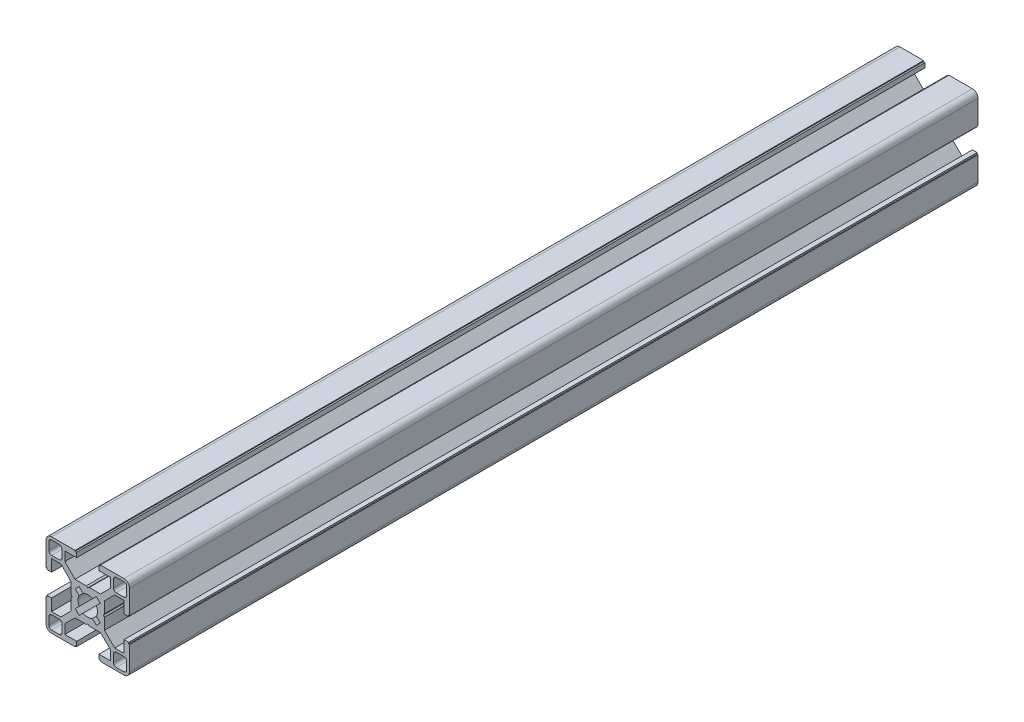
from build123d import *

# Parameters (mm, degrees)
BOSS_EXTRUDE1_DEPTH      = 152.4
BOSS_EXTRUDE1_DEPTH_BACK = 152.4
SKETCH3_R                = 3.5
CUT_EXTRUDE1_DEPTH       = 306.537297232


with BuildPart() as part:
    # Sketch3 → Boss-Extrude1 (new, two sides: drawn at the far end of the back side and taken through both)
    with BuildSketch(Plane.XY.offset(-BOSS_EXTRUDE1_DEPTH_BACK)):
        with BuildLine():
            Line((-4.55, 15), (-4.55, 14.666666667))
            Line((-4.55, 14.666666667), (-4, 14.666666667))
            Line((-4, 14.666666667), (-4, 13))
            Line((-4, 13), (-8.25, 13))
            Line((-8.25, 13), (-8.25, 9.664213562))
            Line((-8.25, 9.664213562), (-4.585786438, 6))
            Line((-4.585786438, 6), (4.585786438, 6))
            Line((4.585786438, 6), (8.25, 9.664213562))
            Line((8.25, 9.664213562), (8.25, 13))
            Line((8.25, 13), (4, 13))
            Line((4, 13), (4, 14.666666667))
            Line((4, 14.666666667), (4.55, 14.666666667))
            Line((4.55, 14.666666667), (4.55, 15))
            Line((4.55, 15), (13, 15))
            ThreePointArc((13, 15), (14.414213562, 14.414213562), (15, 13))
            Line((15, 13), (15, 4.55))
            Line((15, 4.55), (14.666666667, 4.55))
            Line((14.666666667, 4.55), (14.666666667, 4))
            Line((14.666666667, 4), (13, 4))
            Line((13, 4), (13, 8.25))
            Line((13, 8.25), (9.664213562, 8.25))
            Line((9.664213562, 8.25), (6, 4.585786438))
            Line((6, 4.585786438), (6, -4.585786438))
            Line((6, -4.585786438), (9.664213562, -8.25))
            Line((9.664213562, -8.25), (13, -8.25))
            Line((13, -8.25), (13, -4))
            Line((13, -4), (14.666666667, -4))
            Line((14.666666667, -4), (14.666666667, -4.55))
            Line((14.666666667, -4.55), (15, -4.55))
            Line((15, -4.55), (15, -13))
            ThreePointArc((15, -13), (14.414213562, -14.414213562), (13, -15))
            Line((13, -15), (4.55, -15))
            Line((4.55, -15), (4.55, -14.666666667))
            Line((4.55, -14.666666667), (4, -14.666666667))
            Line((4, -14.666666667), (4, -13))
            Line((4, -13), (8.25, -13))
            Line((8.25, -13), (8.25, -9.664213562))
            Line((8.25, -9.664213562), (4.585786438, -6))
            Line((4.585786438, -6), (-4.585786438, -6))
            Line((-4.585786438, -6), (-8.25, -9.664213562))
            Line((-8.25, -9.664213562), (-8.25, -13))
            Line((-8.25, -13), (-4, -13))
            Line((-4, -13), (-4, -14.666666667))
            Line((-4, -14.666666667), (-4.55, -14.666666667))
            Line((-4.55, -14.666666667), (-4.55, -15))
            Line((-4.55, -15), (-13, -15))
            ThreePointArc((-13, -15), (-14.414213562, -14.414213562), (-15, -13))
            Line((-15, -13), (-15, -4.55))
            Line((-15, -4.55), (-14.666666667, -4.55))
            Line((-14.666666667, -4.55), (-14.666666667, -4))
            Line((-14.666666667, -4), (-13, -4))
            Line((-13, -4), (-13, -8.25))
            Line((-13, -8.25), (-9.664213562, -8.25))
            Line((-9.664213562, -8.25), (-6, -4.585786438))
            Line((-6, -4.585786438), (-6, 4.585786438))
            Line((-6, 4.585786438), (-9.664213562, 8.25))
            Line((-9.664213562, 8.25), (-13, 8.25))
            Line((-13, 8.25), (-13, 4))
            Line((-13, 4), (-14.666666667, 4))
            Line((-14.666666667, 4), (-14.666666667, 4.55))
            Line((-14.666666667, 4.55), (-15, 4.55))
            Line((-15, 4.55), (-15, 13))
            ThreePointArc((-15, 13), (-14.414213562, 14.414213562), (-13, 15))
            Line((-13, 15), (-4.55, 15))
        make_face()
        with Locations(Location((0, 0, 0), (0, 0, 180))):
            Circle(SKETCH3_R, mode=Mode.SUBTRACT)
        with BuildLine():
            Line((-13, 9.25), (-10.25, 9.25))
            ThreePointArc((-10.25, 9.25), (-9.542893219, 9.542893219), (-9.25, 10.25))
            Line((-9.25, 10.25), (-9.25, 13))
            ThreePointArc((-9.25, 13), (-9.542893219, 13.707106781), (-10.25, 14))
            Line((-10.25, 14), (-13, 14))
            ThreePointArc((-13, 14), (-13.707106781, 13.707106781), (-14, 13))
            Line((-14, 13), (-14, 10.25))
            ThreePointArc((-14, 10.25), (-13.707106781, 9.542893219), (-13, 9.25))
        make_face(mode=Mode.SUBTRACT)
        with BuildLine():
            Line((9.25, 13), (9.25, 10.25))
            ThreePointArc((9.25, 10.25), (9.542893219, 9.542893219), (10.25, 9.25))
            Line((10.25, 9.25), (13, 9.25))
            ThreePointArc((13, 9.25), (13.707106781, 9.542893219), (14, 10.25))
            Line((14, 10.25), (14, 13))
            ThreePointArc((14, 13), (13.707106781, 13.707106781), (13, 14))
            Line((13, 14), (10.25, 14))
            ThreePointArc((10.25, 14), (9.542893219, 13.707106781), (9.25, 13))
        make_face(mode=Mode.SUBTRACT)
        with BuildLine():
            Line((13, -9.25), (10.25, -9.25))
            ThreePointArc((10.25, -9.25), (9.542893219, -9.542893219), (9.25, -10.25))
            Line((9.25, -10.25), (9.25, -13))
            ThreePointArc((9.25, -13), (9.542893219, -13.707106781), (10.25, -14))
            Line((10.25, -14), (13, -14))
            ThreePointArc((13, -14), (13.707106781, -13.707106781), (14, -13))
            Line((14, -13), (14, -10.25))
            ThreePointArc((14, -10.25), (13.707106781, -9.542893219), (13, -9.25))
        make_face(mode=Mode.SUBTRACT)
        with BuildLine():
            Line((-9.25, -13), (-9.25, -10.25))
            ThreePointArc((-9.25, -10.25), (-9.542893219, -9.542893219), (-10.25, -9.25))
            Line((-10.25, -9.25), (-13, -9.25))
            ThreePointArc((-13, -9.25), (-13.707106781, -9.542893219), (-14, -10.25))
            Line((-14, -10.25), (-14, -13))
            ThreePointArc((-14, -13), (-13.707106781, -13.707106781), (-13, -14))
            Line((-13, -14), (-10.25, -14))
            ThreePointArc((-10.25, -14), (-9.542893219, -13.707106781), (-9.25, -13))
        make_face(mode=Mode.SUBTRACT)
    extrude(amount=BOSS_EXTRUDE1_DEPTH + BOSS_EXTRUDE1_DEPTH_BACK)

    # Sketch4 → Cut-Extrude1 (cut, through all)
    with BuildSketch(Plane.XY.offset(152.4)):
        Polygon((-0.535555503, 6), (0, 5.625), (0.535555503, 6), align=None)
        Polygon((6, 0.535555503), (5.625, 0), (6, -0.535555503), align=None)
        Polygon((0.535555503, -6), (0, -5.625), (-0.535555503, -6), align=None)
        Polygon((-6, -0.535555503), (-5.625, 0), (-6, 0.535555503), align=None)
        with BuildLine():
            Line((-4.493028589, 3.078815026), (-3.078815026, 1.664601464))
            ThreePointArc((-3.078815026, 1.664601464), (-2.474873734, 2.474873734), (-1.664601464, 3.078815026))
            Line((-1.664601464, 3.078815026), (-3.078815026, 4.493028589))
            Line((-3.078815026, 4.493028589), (-4.493028589, 3.078815026))
        make_face()
        with BuildLine():
            Line((3.078815026, 4.493028589), (1.664601464, 3.078815026))
            ThreePointArc((1.664601464, 3.078815026), (2.474873734, 2.474873734), (3.078815026, 1.664601464))
            Line((3.078815026, 1.664601464), (4.493028589, 3.078815026))
            Line((4.493028589, 3.078815026), (3.078815026, 4.493028589))
        make_face()
        with BuildLine():
            Line((4.493028589, -3.078815026), (3.078815026, -1.664601464))
            ThreePointArc((3.078815026, -1.664601464), (2.474873734, -2.474873734), (1.664601464, -3.078815026))
            Line((1.664601464, -3.078815026), (3.078815026, -4.493028589))
            Line((3.078815026, -4.493028589), (4.493028589, -3.078815026))
        make_face()
        with BuildLine():
            Line((-3.078815026, -4.493028589), (-1.664601464, -3.078815026))
            ThreePointArc((-1.664601464, -3.078815026), (-2.474873734, -2.474873734), (-3.078815026, -1.664601464))
            Line((-3.078815026, -1.664601464), (-4.493028589, -3.078815026))
            Line((-4.493028589, -3.078815026), (-3.078815026, -4.493028589))
        make_face()
    extrude(amount=-CUT_EXTRUDE1_DEPTH, mode=Mode.SUBTRACT)


solid = part.part
